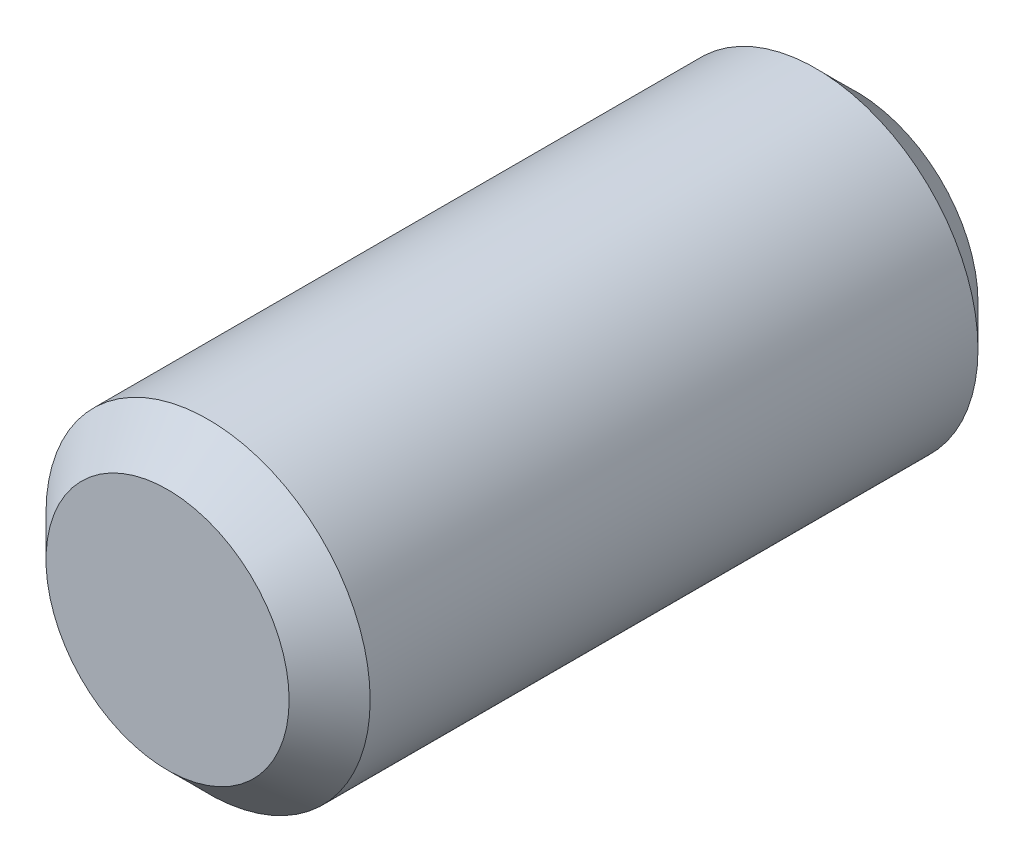
from build123d import *

# Parameters (mm, degrees)
SKETCH_1_R      = 2
EXTRUDE_1_DEPTH = 8.5
CHAMFER_1_SIZE  = 0.5


with BuildPart() as part:
    # 草图1 → 拉伸1 (new body)
    with BuildSketch(Plane.XY):
        Circle(SKETCH_1_R)
    extrude(amount=EXTRUDE_1_DEPTH)

    # 倒角1
    chamfer_1_edges = [part.edges().sort_by_distance(p)[0] for p in [
        (-2, 0, 0),
        (-2, 0, 8.5),
    ]]
    chamfer(chamfer_1_edges, length=CHAMFER_1_SIZE)


solid = part.part
